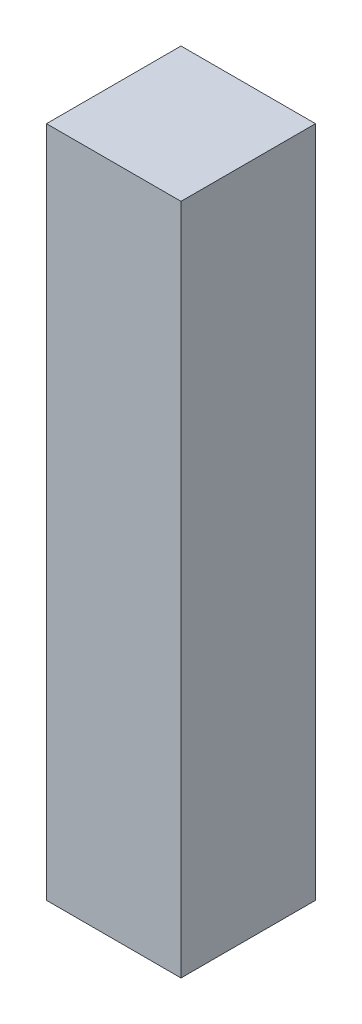
from build123d import *

# Parameters (mm, degrees)
SKETCH1_W           = 100
SKETCH1_H           = 100
BOSS_EXTRUDE1_DEPTH = 500


with BuildPart() as part:
    # Sketch1 → Boss-Extrude1 (new body)
    with BuildSketch(Plane(origin=(0, 0, 0), x_dir=(1, 0, 0), z_dir=(0, 1, 0))):
        with Locations((50, 50)):
            Rectangle(SKETCH1_W, SKETCH1_H)
    extrude(amount=BOSS_EXTRUDE1_DEPTH)


solid = part.part
